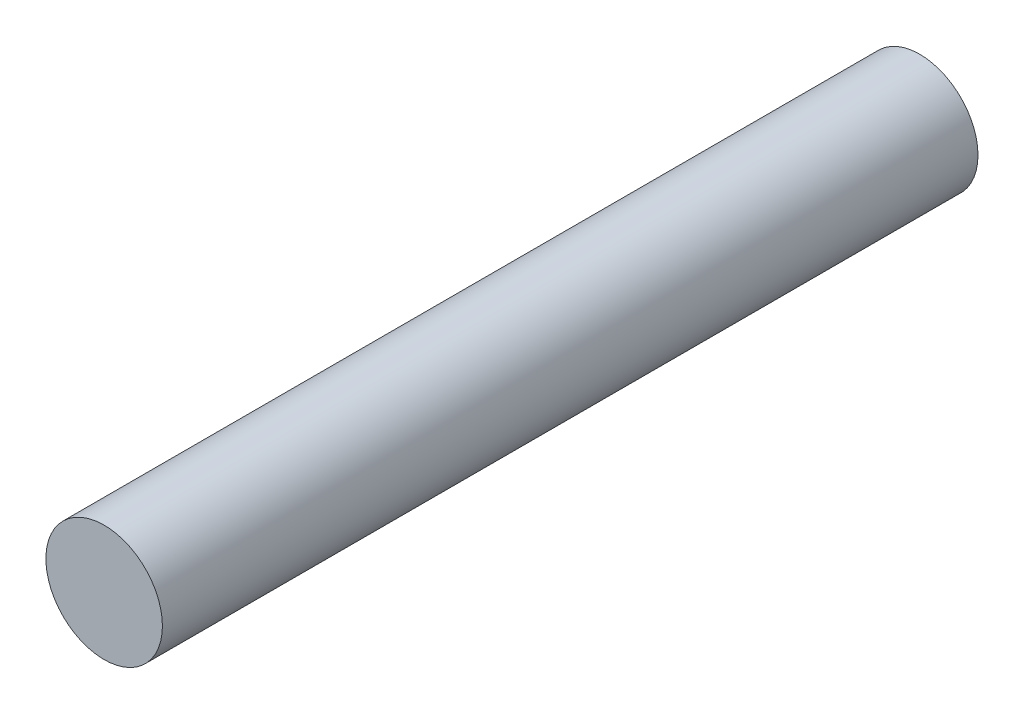
from build123d import *

# Parameters (mm, degrees)
SKETCH1_R           = 2
BOSS_EXTRUDE1_DEPTH = 14


with BuildPart() as part:
    # Sketch1 → Boss-Extrude1 (new, symmetric)
    with BuildSketch(Plane.XY):
        Circle(SKETCH1_R)
    extrude(amount=BOSS_EXTRUDE1_DEPTH, both=True)


solid = part.part
